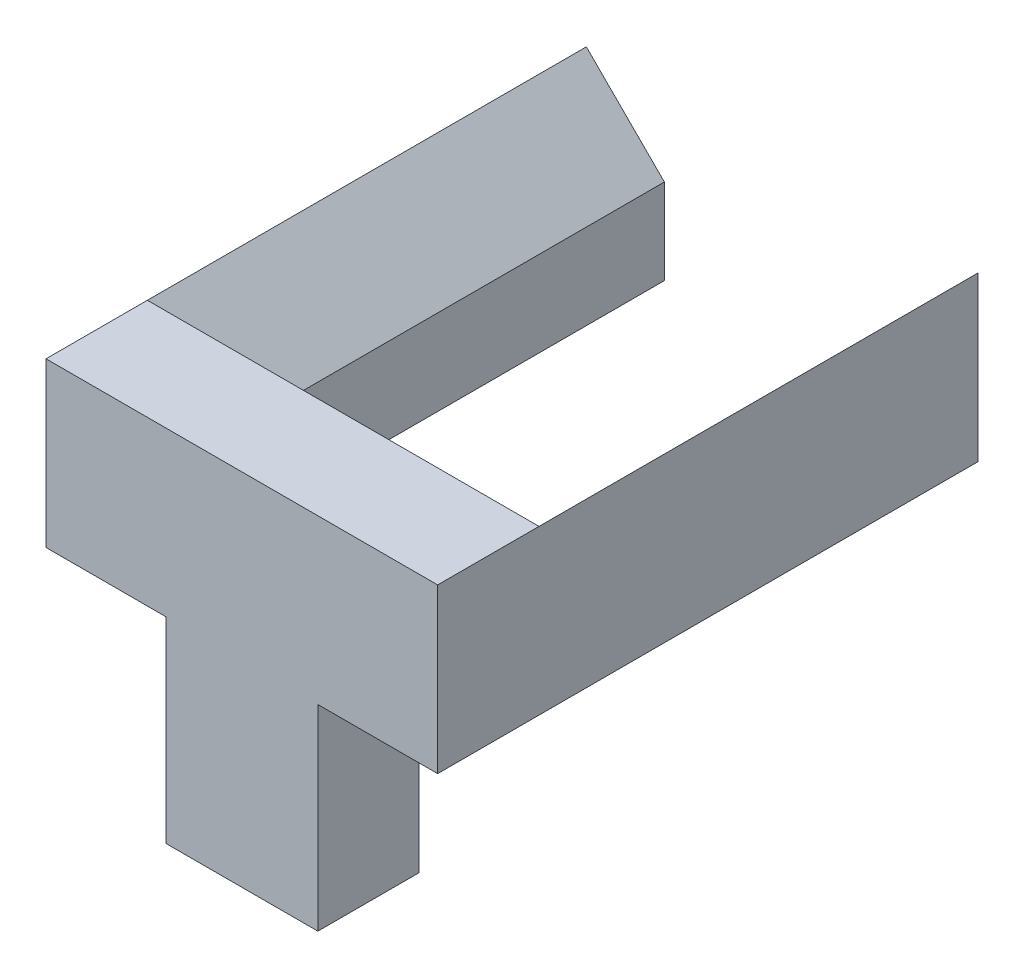
from build123d import *

# Parameters (mm, degrees)
SKETCH1_W           = 38.1
SKETCH1_H           = 25.4
BOSS_EXTRUDE1_DEPTH = 90.1598
SKETCH2_W           = 25.4
SKETCH2_H           = 40.96
BOSS_EXTRUDE2_DEPTH = 30.0228
SKETCH3_W           = 25.4
SKETCH3_H           = 40.96
BOSS_EXTRUDE3_DEPTH = 30.0228
BOSS_EXTRUDE4_DEPTH = 110.0074
BOSS_EXTRUDE5_DEPTH = 110.0074
SKETCH8_R           = 3.81
CUT_EXTRUDE1_DEPTH  = 25.4


with BuildPart() as part:
    # Sketch1 → Boss-Extrude1 (new body)
    with BuildSketch(Plane(origin=(0, 0, 0), x_dir=(1, 0, 0), z_dir=(0, 1, 0))):
        with Locations((5.061883246, 0.142486096)):
            Rectangle(SKETCH1_W, SKETCH1_H)
    extrude(amount=BOSS_EXTRUDE1_DEPTH)

    # Sketch2 → Boss-Extrude2 (add)
    with BuildSketch(Plane(origin=(24.111883246, 0, 0), x_dir=(0, 0, -1), z_dir=(1, 0, 0))):
        with Locations((0.142486096, 69.6798)):
            Rectangle(SKETCH2_W, SKETCH2_H)
    extrude(amount=BOSS_EXTRUDE2_DEPTH)

    # Sketch3 → Boss-Extrude3 (add)
    with BuildSketch(Plane.ZY.offset(13.988116754)):
        with Locations((-0.142486096, 69.6798)):
            Rectangle(SKETCH3_W, SKETCH3_H)
    extrude(amount=BOSS_EXTRUDE3_DEPTH)

    # Sketch4 → Boss-Extrude4 (add)
    with BuildSketch(Plane(origin=(0, 0, -12.842486096), x_dir=(-1, 0, 0), z_dir=(0, 0, -1))):
        Polygon((-54.134683246, 90.1598), (-54.134683246, 49.1998), (-34.576683246, 49.1998), (-34.576683246, 70.6018), align=None)
    extrude(amount=BOSS_EXTRUDE4_DEPTH)

    # Sketch5 → Boss-Extrude5 (add)
    with BuildSketch(Plane(origin=(0, 0, -12.842486096), x_dir=(-1, 0, 0), z_dir=(0, 0, -1))):
        Polygon((44.010916754, 90.1598), (44.010916754, 49.1998), (24.452916754, 49.1998), (24.452916754, 70.6018), align=None)
    extrude(amount=BOSS_EXTRUDE5_DEPTH)

    # Sketch8 → Cut-Extrude1 (cut)
    with BuildSketch(Plane.XZ):
        with Locations(Location((-4.938116754, -0.142486096, 0), (0, 0, 270))):
            Circle(SKETCH8_R)
        with Locations(Location((15.061883246, -0.142486096, 0), (0, 0, 270))):
            Circle(SKETCH8_R)
    extrude(amount=-CUT_EXTRUDE1_DEPTH, mode=Mode.SUBTRACT)


solid = part.part
